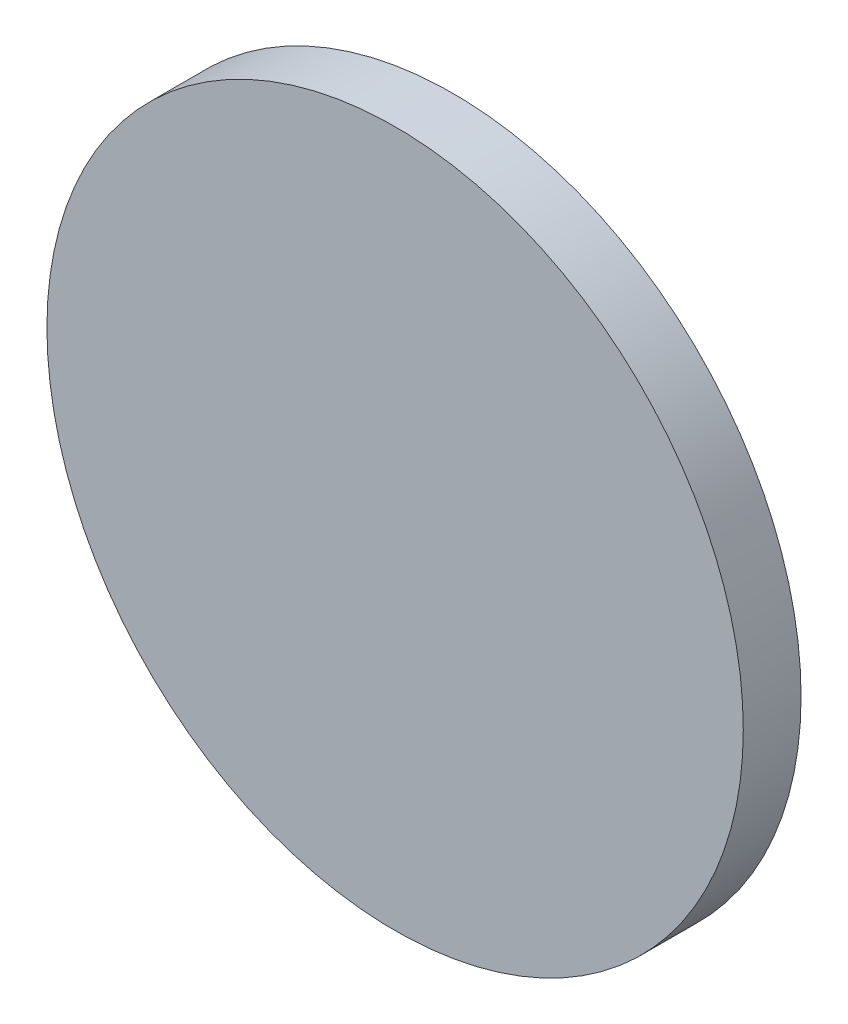
from build123d import *

# Parameters (mm, degrees)
SKETCH_1_R      = 301.20433214
EXTRUDE_1_DEPTH = 50


with BuildPart() as part:
    # Эскиз1 → Бобышка-Вытянуть1 (new body)
    with BuildSketch(Plane.XY):
        with Locations((-58.145438853, 33.858989922)):
            Circle(SKETCH_1_R)
    extrude(amount=EXTRUDE_1_DEPTH)


solid = part.part
